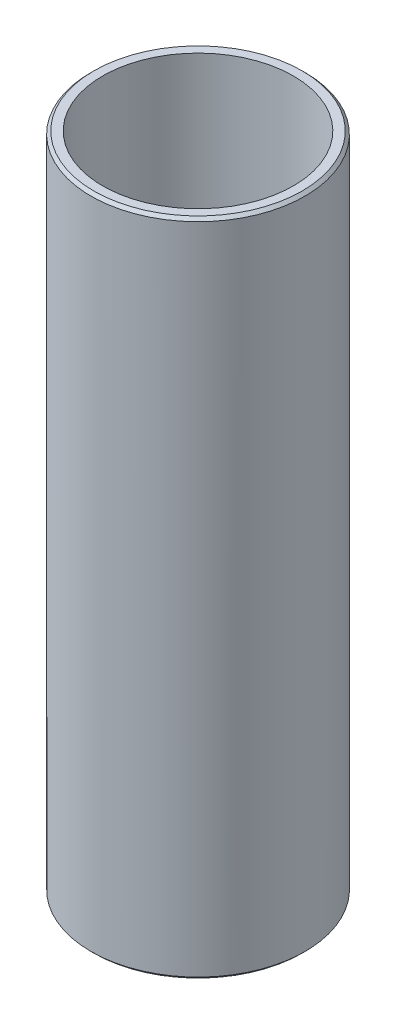
from build123d import *

# Parameters (mm, degrees)
SKETCH1_R           = 7.3
SKETCH1_R_2         = 6.5
BOSS_EXTRUDE1_DEPTH = 45
CHAMFER1_SIZE       = 0.2


with BuildPart() as part:
    # Sketch1 → Boss-Extrude1 (new body)
    with BuildSketch(Plane(origin=(0, 0, 0), x_dir=(1, 0, 0), z_dir=(0, 1, 0))):
        with Locations(Location((0, 0, 0), (0, 0, 90))):
            Circle(SKETCH1_R)
        with Locations(Location((0, 0, 0), (0, 0, 90))):
            Circle(SKETCH1_R_2, mode=Mode.SUBTRACT)
    extrude(amount=BOSS_EXTRUDE1_DEPTH)

    # Chamfer1
    chamfer1_edges = [part.edges().sort_by_distance(p)[0] for p in [
        (0, 0, 7.3),
        (0, 45, 7.3),
    ]]
    chamfer(chamfer1_edges, length=CHAMFER1_SIZE)


solid = part.part
